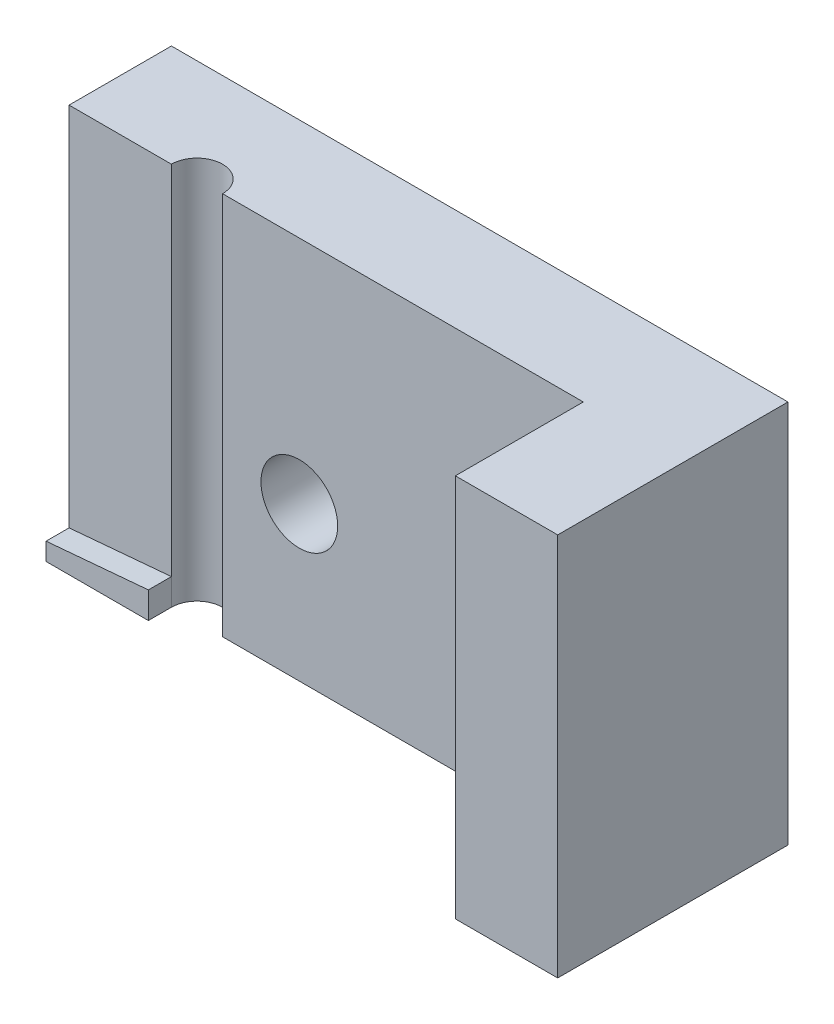
from build123d import *

# Parameters (mm, degrees)
SKETCH_1_W          = 24.1
SKETCH_1_H          = 15
EXTRUDE_1_DEPTH     = 4
CUT_EXTRUDE_1_DEPTH = 15
EXTRUDE_2_DEPTH     = 0.9
SKETCH_4_R          = 1.5
CUT_EXTRUDE_2_DEPTH = 4
SKETCH_5_W          = 4
SKETCH_5_H          = 15
EXTRUDE_3_DEPTH     = 5


with BuildPart() as part:
    # 草图1 → 凸台-拉伸1 (new body)
    with BuildSketch(Plane.XY):
        Rectangle(SKETCH_1_W, SKETCH_1_H)
    extrude(amount=-EXTRUDE_1_DEPTH)

    # 草图2 → 切除-拉伸1 (cut)
    with BuildSketch(Plane.XZ.offset(7.5)):
        with BuildLine():
            Line((-8.05, 0), (-6.05, 0))
            ThreePointArc((-6.05, 0), (-7.05, -1), (-8.05, 0))
        make_face()
    extrude(amount=-CUT_EXTRUDE_1_DEPTH, mode=Mode.SUBTRACT)

    # 草图3 → 凸台-拉伸2 (add)
    with BuildSketch(Plane.XY):
        Polygon((-8.05, -6.462156705), (-8.05, -7.5), (-12.05, -7.5), (-12.05, -6.812111359), align=None)
    extrude(amount=EXTRUDE_2_DEPTH)

    # 草图4 → 切除-拉伸2 (cut)
    with BuildSketch(Plane.XY):
        with Locations((-3.05, -1.5)):
            Circle(SKETCH_4_R)
    extrude(amount=-CUT_EXTRUDE_2_DEPTH, mode=Mode.SUBTRACT)

    # 草图5 → 凸台-拉伸3 (add)
    with BuildSketch(Plane.XY):
        with Locations((10.05, 0)):
            Rectangle(SKETCH_5_W, SKETCH_5_H)
    extrude(amount=EXTRUDE_3_DEPTH)


solid = part.part
